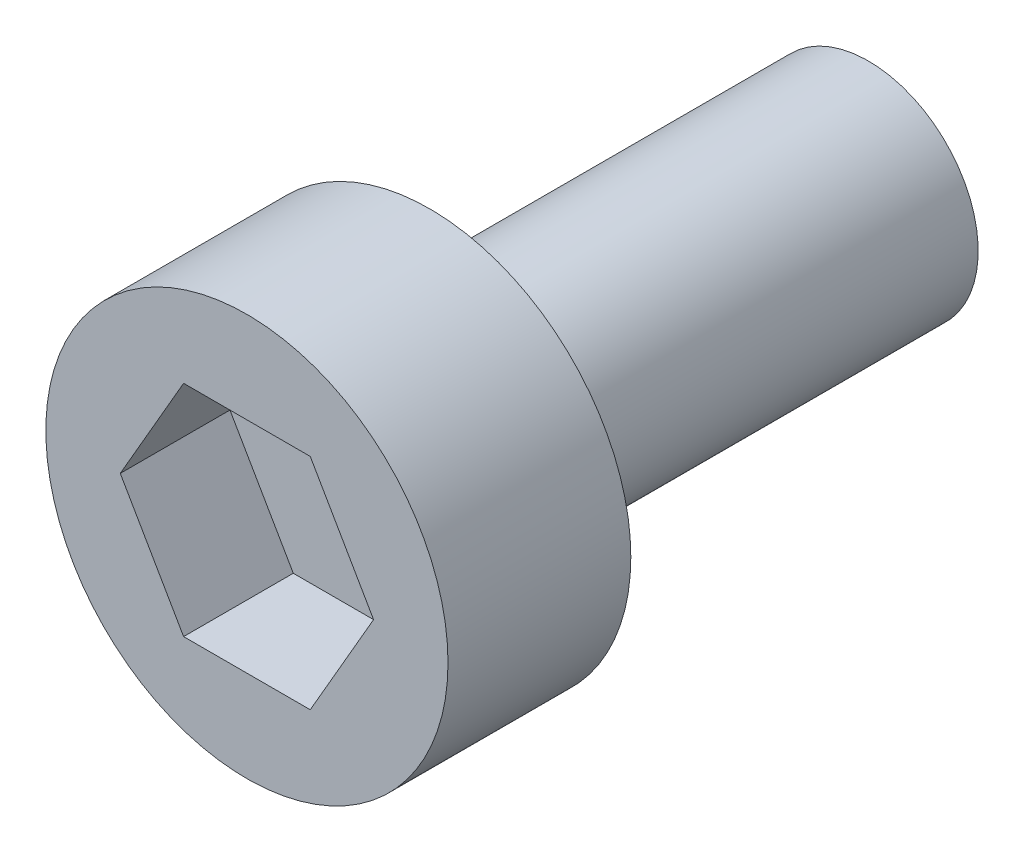
from build123d import *

# Parameters (mm, degrees)
SKETCH_1_R      = 2.75
EXTRUDE_1_DEPTH = 2.5
SKETCH_2_R      = 1.5
EXTRUDE_2_DEPTH = 6
EXTRUDE_3_DEPTH = 1


with BuildPart() as part:
    # 草图1 → 凸台-拉伸1 (new body)
    with BuildSketch(Plane.XY):
        Circle(SKETCH_1_R)
        Polygon((1.732050808, 0), (0.866025404, 1.5), (-0.866025404, 1.5), (-1.732050808, 0), (-0.866025404, -1.5), (0.866025404, -1.5), align=None, mode=Mode.SUBTRACT)
    extrude(amount=EXTRUDE_1_DEPTH)



with BuildPart() as body_2:
    # 草图2 → 凸台-拉伸2 (new body)
    with BuildSketch(Plane(origin=(0, 0, 0), x_dir=(-1, 0, 0), z_dir=(0, 0, -1))):
        Circle(SKETCH_2_R)
    extrude(amount=EXTRUDE_2_DEPTH)


with BuildPart() as part_1:
    add(part.part)

    add(body_2.part)  # 凸台-拉伸3 merges body 2
    # 草图1<3> → 凸台-拉伸3 (add)
    with BuildSketch(Plane.XY):
        Polygon((-0.866025404, -1.5), (0.866025404, -1.5), (1.732050808, 0), (0.866025404, 1.5), (-0.866025404, 1.5), (-1.732050808, 0), align=None)
    extrude(amount=EXTRUDE_3_DEPTH)


solid = part_1.part
